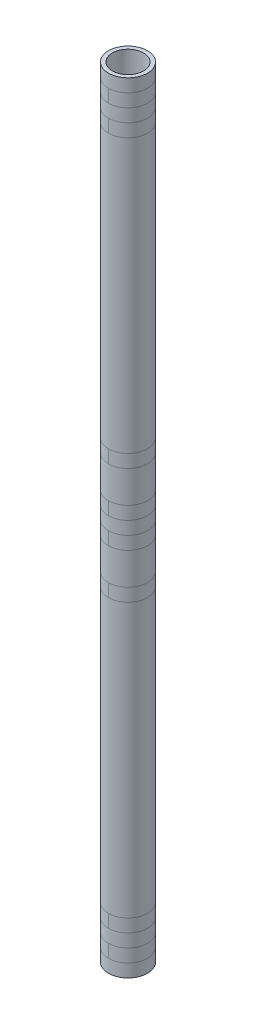
from build123d import *

# Parameters (mm, degrees)
SKETCH1_R           = 15
BOSS_EXTRUDE1_DEPTH = 600
SKETCH5_R           = 12
CUT_EXTRUDE1_DEPTH  = 600


with BuildPart() as part:
    # Sketch1 → Boss-Extrude1 (new body)
    with BuildSketch(Plane(origin=(0, 0, 0), x_dir=(1, 0, 0), z_dir=(0, 1, 0))):
        with Locations(Location((0, 0, 0), (0, 0, 270))):
            Circle(SKETCH1_R)
    extrude(amount=BOSS_EXTRUDE1_DEPTH)

    # Sketch5 → Cut-Extrude1 (cut)
    with BuildSketch(Plane(origin=(0, 600, 0), x_dir=(1, 0, 0), z_dir=(0, 1, 0))):
        with Locations(Location((0, 0, 0), (0, 0, 270))):
            Circle(SKETCH5_R)
    extrude(amount=-CUT_EXTRUDE1_DEPTH, mode=Mode.SUBTRACT)


solid = part.part
